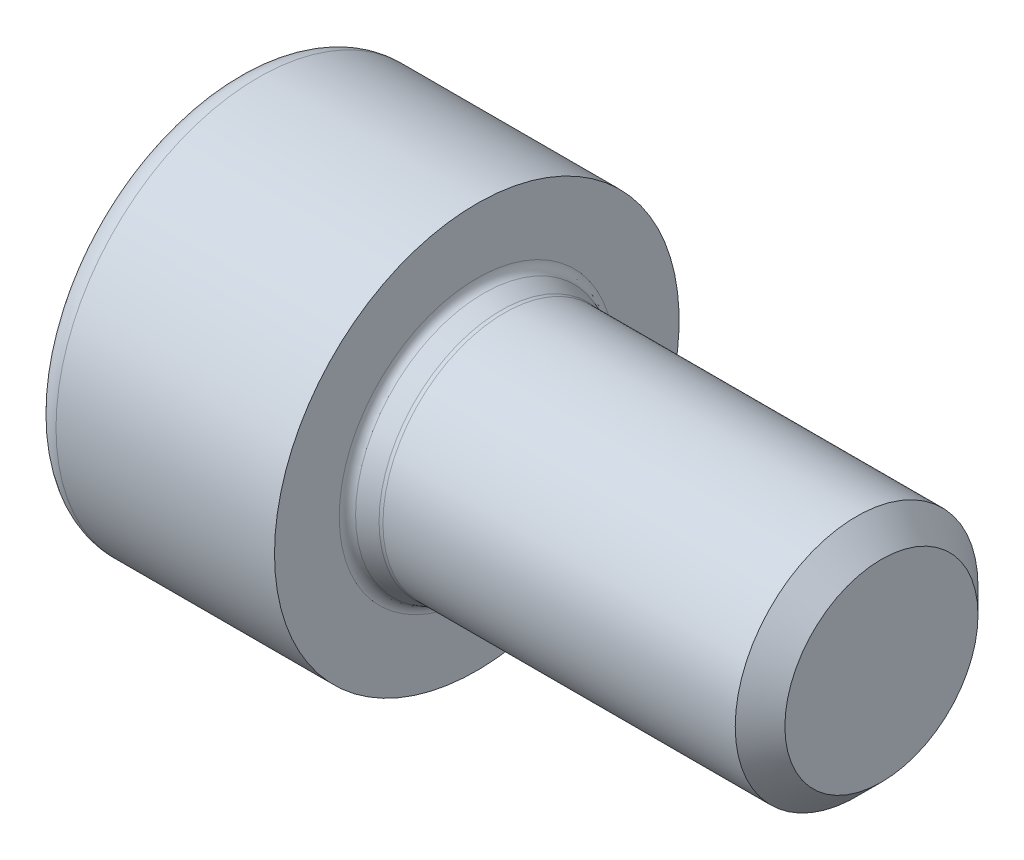
from build123d import *

# Parameters (mm, degrees)
CUT_EXTRUDE_1_DEPTH = 6
SKETCH_3_R          = 3.75
EXTRUDE_1_DEPTH     = 3


with BuildPart() as part:
    # 草图1 → 旋转1 (revolve)
    with BuildSketch(Plane.XY, mode=Mode.PRIVATE) as revolve_1_sk:
        with BuildLine():
            Line((-0.856624327, 0), (-2.3, 2.5))
            Line((-2.3, 2.5), (-6, 2.5))
            Line((-6, 2.5), (-6, 4.4))
            ThreePointArc((-6, 4.4), (-5.824264069, 4.824264069), (-5.4, 5))
            Line((-5.4, 5), (0, 5))
            Line((0, 5), (0, 3.4))
            ThreePointArc((0, 3.4), (0.046179295, 3.255234258), (0.167656961, 3.163949955))
            Line((0.167656961, 3.163949955), (0.597656961, 3.013949955))
            ThreePointArc((0.597656961, 3.013949955), (0.638241835, 3.003512159), (0.68, 3))
            Line((0.68, 3), (9.3865, 3))
            Line((9.3865, 3), (10, 2.3865))
            Line((10, 2.3865), (10, 0))
            Line((10, 0), (-0.856624327, 0))
        make_face()
    revolve(revolve_1_sk.sketch.rotate(Axis((10, 0, 0), (-1, 0, 0)), 270), axis=Axis((10, 0, 0), (-1, 0, 0)))

    # 草图2 → 切除-拉伸1 (cut)
    with BuildSketch(Plane(origin=(-2.3, 0, 0), x_dir=(0, 0, -1), z_dir=(1, 0, 0))):
        Polygon((-2.5, 1.443375673), (-2.5, -1.443375673), (0, -2.886751346), (2.5, -1.443375673), (2.5, 1.443375673), (0, 2.886751346), align=None)
    extrude(amount=-CUT_EXTRUDE_1_DEPTH, mode=Mode.SUBTRACT)


with BuildPart() as body_2:
    # 草图3 → 凸台-拉伸1 (new body)
    with BuildSketch(Plane(origin=(0, 0, 0), x_dir=(0, 0, -1), z_dir=(1, 0, 0))):
        Circle(SKETCH_3_R)
    extrude(amount=-EXTRUDE_1_DEPTH)

    # Delete Face 1: 1 face struck out; the rest of the skin is kept as a surface, the solid goes
    delete_face_1_1_drop = [body_2.part.faces().sort_by_distance(Vector(p))[0] for p in ((-3, 0, 0),)]
    delete_face_1_1 = Shell(body_2.part.faces() - delete_face_1_1_drop)


solid = part.part
